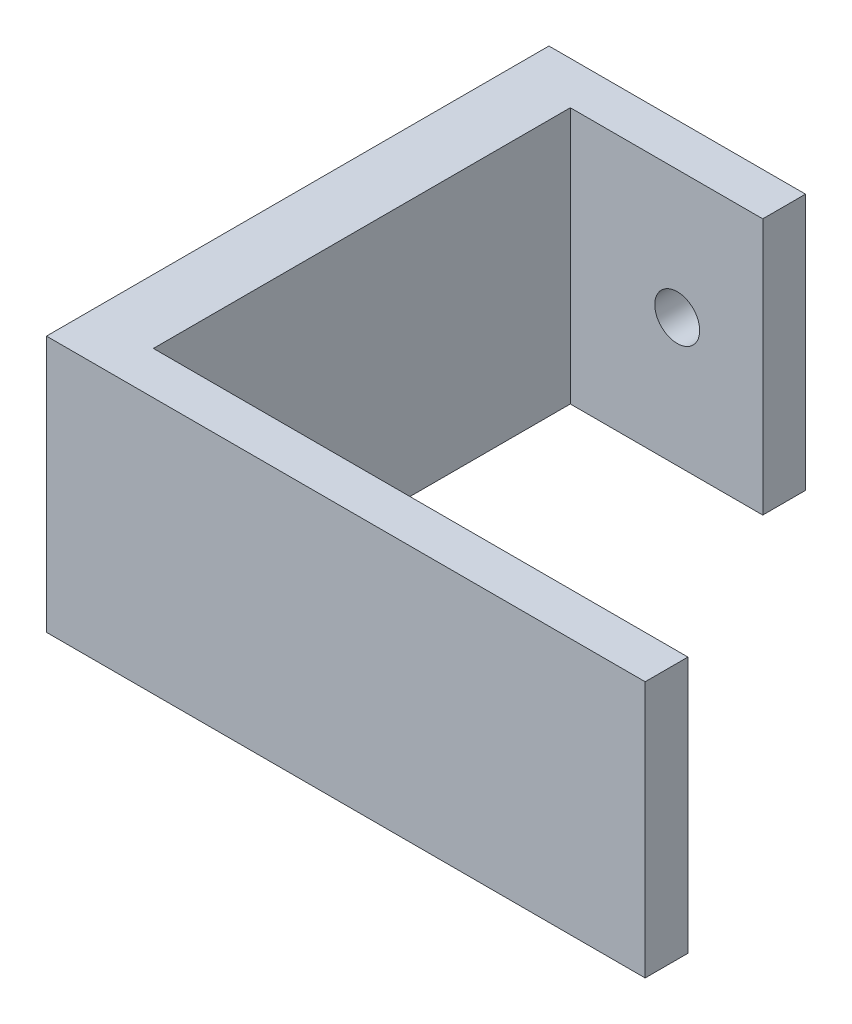
from build123d import *

# Parameters (mm, degrees)
LINK_EYE_SHELF_START      = -23.5
SKETCH1_W                 = 12
SKETCH1_H                 = 12
SKETCH1_R                 = 1.05
LINK_EYE_SHELF_DEPTH      = 2
OUTBOARD_WEB_START        = -22.5
SKETCH2_W                 = 3
SKETCH2_H                 = 12
OUTBOARD_WEB_DEPTH        = 21.5
CARRIAGE_PLATE_FOOT_START = -2
SKETCH3_W                 = 28
SKETCH3_H                 = 12
CARRIAGE_PLATE_FOOT_DEPTH = 2


with BuildPart() as part:
    # Sketch1 → Link_Eye_Shelf (new body)
    with BuildSketch(Plane.XY.offset(LINK_EYE_SHELF_START)):
        with Locations((-38, -20)):
            Rectangle(SKETCH1_W, SKETCH1_H)
        with Locations((-36, -20)):
            Circle(SKETCH1_R, mode=Mode.SUBTRACT)
    extrude(amount=LINK_EYE_SHELF_DEPTH)

    # Sketch2 → Outboard_Web (add)
    with BuildSketch(Plane.XY.offset(OUTBOARD_WEB_START)):
        with Locations((-42.5, -20)):
            Rectangle(SKETCH2_W, SKETCH2_H)
    extrude(amount=OUTBOARD_WEB_DEPTH)

    # Sketch3 → Carriage_Plate_Foot (add)
    with BuildSketch(Plane.XY.offset(CARRIAGE_PLATE_FOOT_START)):
        with Locations((-30, -20)):
            Rectangle(SKETCH3_W, SKETCH3_H)
    extrude(amount=CARRIAGE_PLATE_FOOT_DEPTH)


solid = part.part
